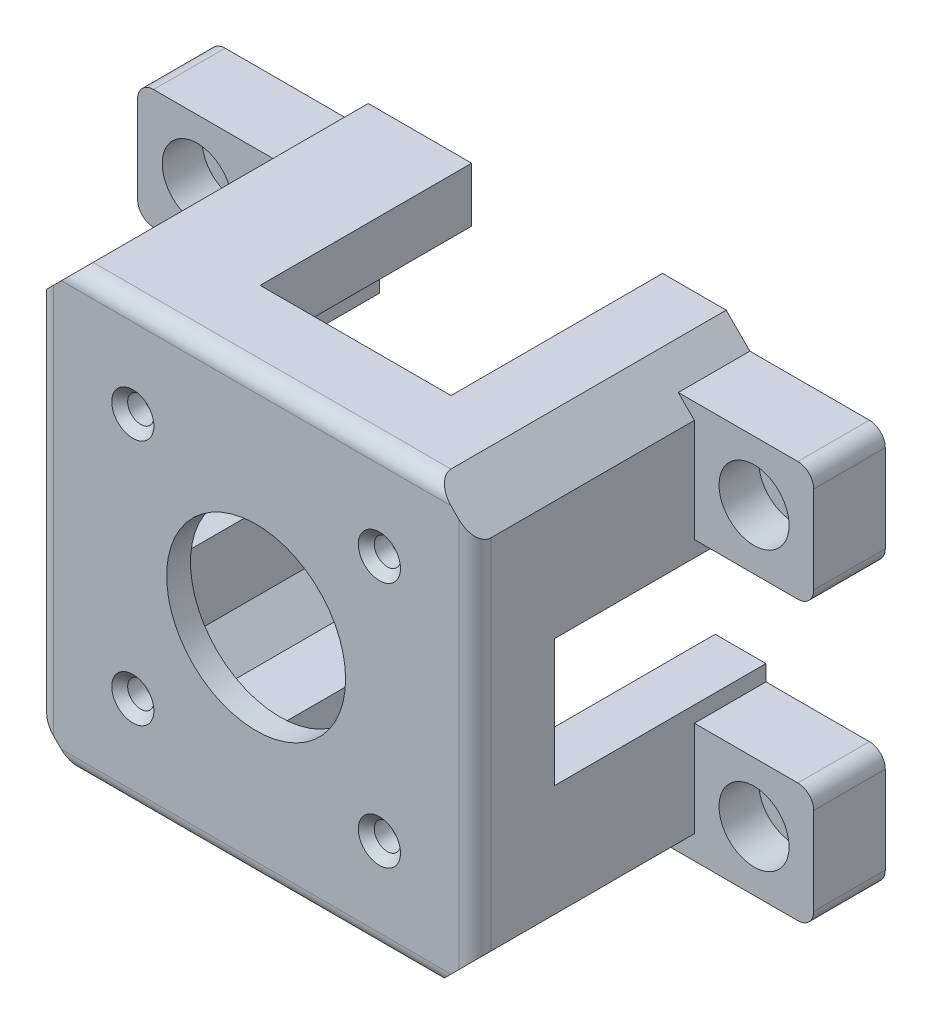
from build123d import *

# Parameters (mm, degrees)
SKETCH2_W           = 55
SKETCH2_H           = 55
BOSS_EXTRUDE1_DEPTH = 33.6
BOSS_EXTRUDE2_DEPTH = 3
SKETCH4_W           = 15
SKETCH4_H           = 15
SKETCH4_R           = 2.6
BOSS_EXTRUDE3_DEPTH = 9
CUT_EXTRUDE1_START  = -5
SKETCH6_R           = 4.4
SKETCH6_R_2         = 2.6
CUT_EXTRUDE1_DEPTH  = 5
CHAMFER1_SIZE       = 5
FILLET4_R           = 2
SKETCH7_W           = 24
SKETCH7_H           = 26.6
CUT_EXTRUDE2_DEPTH  = 67
SKETCH8_W           = 26.6
SKETCH8_H           = 16
CUT_EXTRUDE3_DEPTH  = 67
SKETCH10_R          = 1.65
CUT_EXTRUDE4_DEPTH  = 10
CHAMFER2_SIZE       = 1


with BuildPart() as part:
    # Sketch2 → Boss-Extrude1 (new body)
    with BuildSketch(Plane.XY):
        with Locations((0, 0.476186899)):
            Rectangle(SKETCH2_W, SKETCH2_H)
        Polygon((21.118377871, -17.280631787), (21.118377871, 17.280631787), (17.280631787, 21.118377871), (-17.280631787, 21.118377871), (-21.118377871, 17.280631787), (-21.118377871, -17.280631787), (-17.280631787, -21.118377871), (17.280631787, -21.118377871), align=None, mode=Mode.SUBTRACT)
    extrude(amount=BOSS_EXTRUDE1_DEPTH)

    # Sketch3 → Boss-Extrude2 (add)
    with BuildSketch(Plane.XY.offset(33.6)):
        with BuildLine():
            Line((-7.954951288, 8.431138187), (-18.961411379, 19.437598278))
            Line((-18.961411379, 19.437598278), (-21.118377871, 17.280631787))
            Line((-21.118377871, 17.280631787), (-21.118377871, -17.280631787))
            Line((-21.118377871, -17.280631787), (-19.437598278, -18.961411379))
            Line((-19.437598278, -18.961411379), (-7.954951288, -7.478764389))
            ThreePointArc((-7.954951288, -7.478764389), (-11.25, 0.476186899), (-7.954951288, 8.431138187))
        make_face()
        with BuildLine():
            Line((-7.954951288, -7.478764389), (-19.437598278, -18.961411379))
            Line((-19.437598278, -18.961411379), (-17.280631787, -21.118377871))
            Line((-17.280631787, -21.118377871), (17.280631787, -21.118377871))
            Line((17.280631787, -21.118377871), (19.437598278, -18.961411379))
            Line((19.437598278, -18.961411379), (7.954951288, -7.478764389))
            ThreePointArc((7.954951288, -7.478764389), (0, -10.773813101), (-7.954951288, -7.478764389))
        make_face()
        with BuildLine():
            Line((21.118377871, 17.280631787), (18.961411379, 19.437598278))
            Line((18.961411379, 19.437598278), (7.954951288, 8.431138187))
            ThreePointArc((7.954951288, 8.431138187), (10.393644741, 4.781375513), (11.25, 0.476186899))
            ThreePointArc((11.25, 0.476186899), (10.393644741, -3.829001715), (7.954951288, -7.478764389))
            Line((7.954951288, -7.478764389), (19.437598278, -18.961411379))
            Line((19.437598278, -18.961411379), (21.118377871, -17.280631787))
            Line((21.118377871, -17.280631787), (21.118377871, 17.280631787))
        make_face()
        with BuildLine():
            Line((-17.280631787, 21.118377871), (-18.961411379, 19.437598278))
            Line((-18.961411379, 19.437598278), (-7.954951288, 8.431138187))
            ThreePointArc((-7.954951288, 8.431138187), (0, 11.726186899), (7.954951288, 8.431138187))
            Line((7.954951288, 8.431138187), (18.961411379, 19.437598278))
            Line((18.961411379, 19.437598278), (17.280631787, 21.118377871))
            Line((17.280631787, 21.118377871), (-17.280631787, 21.118377871))
        make_face()
        Polygon((-18.961411379, 19.437598278), (-27.5, 27.976186899), (-27.5, -27.023813101), (-19.437598278, -18.961411379), (-21.118377871, -17.280631787), (-21.118377871, 17.280631787), align=None)
        Polygon((-19.437598278, -18.961411379), (-27.5, -27.023813101), (27.5, -27.023813101), (19.437598278, -18.961411379), (17.280631787, -21.118377871), (-17.280631787, -21.118377871), align=None)
        Polygon((27.5, -27.023813101), (27.5, 27.976186899), (18.961411379, 19.437598278), (21.118377871, 17.280631787), (21.118377871, -17.280631787), (19.437598278, -18.961411379), align=None)
        Polygon((27.5, 27.976186899), (-27.5, 27.976186899), (-18.961411379, 19.437598278), (-17.280631787, 21.118377871), (17.280631787, 21.118377871), (18.961411379, 19.437598278), align=None)
    extrude(amount=BOSS_EXTRUDE2_DEPTH)

    # Sketch4 → Boss-Extrude3 (add)
    # profile 1 of 4: a face of its own
    with BuildSketch(Plane(origin=(0, 0, 0), x_dir=(-1, 0, 0), z_dir=(0, 0, -1))):
        with Locations((-35, 17.5)):
            Rectangle(SKETCH4_W, SKETCH4_H)
        with Locations((-35, 17.5)):
            Circle(SKETCH4_R, mode=Mode.SUBTRACT)
    # profile 2 of 4: a face of its own
    with BuildSketch(Plane(origin=(0, 0, 0), x_dir=(-1, 0, 0), z_dir=(0, 0, -1))):
        with Locations((35, 17.5)):
            Rectangle(SKETCH4_W, SKETCH4_H)
        with Locations((35, 17.5)):
            Circle(SKETCH4_R, mode=Mode.SUBTRACT)
    # profile 3 of 4: a face of its own
    with BuildSketch(Plane(origin=(0, 0, 0), x_dir=(-1, 0, 0), z_dir=(0, 0, -1))):
        with Locations((-35, -17.5)):
            Rectangle(SKETCH4_W, SKETCH4_H)
        with Locations((-35, -17.5)):
            Circle(SKETCH4_R, mode=Mode.SUBTRACT)
    # profile 4 of 4: a face of its own
    with BuildSketch(Plane(origin=(0, 0, 0), x_dir=(-1, 0, 0), z_dir=(0, 0, -1))):
        with Locations((17.5, -34.523813101)):
            Rectangle(SKETCH4_W, SKETCH4_H)
        with Locations((17.5, -34.523813101)):
            Circle(SKETCH4_R, mode=Mode.SUBTRACT)
    extrude(amount=-BOSS_EXTRUDE3_DEPTH)

    # Sketch6 → Cut-Extrude1 (cut)
    # profile 1 of 4: a face of its own
    with BuildSketch(Plane.XY.offset(9).offset(CUT_EXTRUDE1_START)):
        with Locations((-17.5, -34.523813101)):
            Circle(SKETCH6_R)
    # profile 2 of 4: a face of its own
    with BuildSketch(Plane.XY.offset(9).offset(CUT_EXTRUDE1_START)):
        with Locations((-35, 17.5)):
            Circle(SKETCH6_R)
    # profile 3 of 4: a face of its own
    with BuildSketch(Plane.XY.offset(9).offset(CUT_EXTRUDE1_START)):
        with Locations((35, -17.5)):
            Circle(SKETCH6_R)
        with Locations(Location((35, -17.5, 0), (0, 0, 180))):
            Circle(SKETCH6_R_2, mode=Mode.SUBTRACT)
    # profile 4 of 4: a face of its own
    with BuildSketch(Plane.XY.offset(9).offset(CUT_EXTRUDE1_START)):
        with Locations((35, 17.5)):
            Circle(SKETCH6_R)
    extrude(amount=CUT_EXTRUDE1_DEPTH, mode=Mode.SUBTRACT)

    # Chamfer1
    chamfer1_edges = [part.edges().sort_by_distance(p)[0] for p in [
        (27.5, -27.023813101, 18.3),
        (-27.5, -27.023813101, 18.3),
        (27.5, 27.976186899, 18.3),
        (-27.5, 27.976186899, 18.3),
    ]]
    chamfer(chamfer1_edges, length=CHAMFER1_SIZE)

    # Fillet4
    fillet4_edges = [part.edges().sort_by_distance(p)[0] for p in [
        (0, 27.976186899, 36.6),
        (27.5, 0.476186899, 36.6),
        (0, -27.023813101, 36.6),
        (-27.5, 0.476186899, 36.6),
        (-25, -42.023813101, 4.5),
        (-10, -42.023813101, 4.5),
        (-42.5, 10, 4.5),
        (-42.5, 25, 4.5),
        (42.5, -25, 4.5),
        (42.5, -10, 4.5),
        (42.5, 10, 4.5),
        (42.5, 25, 4.5),
    ]]
    fillet(fillet4_edges, radius=FILLET4_R)

    # Sketch7 → Cut-Extrude2 (cut)
    with BuildSketch(Plane.XZ.offset(27.023813101)):
        with Locations((2.5, 13.3)):
            Rectangle(SKETCH7_W, SKETCH7_H)
    extrude(amount=-CUT_EXTRUDE2_DEPTH, mode=Mode.SUBTRACT)

    # Sketch8 → Cut-Extrude3 (cut)
    with BuildSketch(Plane.ZY.offset(27.5)):
        with Locations((13.3, 0)):
            Rectangle(SKETCH8_W, SKETCH8_H)
    extrude(amount=-CUT_EXTRUDE3_DEPTH, mode=Mode.SUBTRACT)


with BuildPart() as body_2:
    # Mirror2: mirrored copy
    add(part.part.mirror(Plane(origin=(-25, -42.023813101, 9), x_dir=(0, 0, 1), z_dir=(0, 1, 0))))


with BuildPart() as body_2_2:
    # Mirror3: mirrored copy
    add(body_2.part.mirror(Plane(origin=(-1.737426519, -112.023813101, 20.07988243), x_dir=(0, 0, 1), z_dir=(0, -1, 0))))

    # Sketch10 → Cut-Extrude4 (cut)
    with BuildSketch(Plane.XY.offset(36.6)):
        with Locations((-15.5, -124.023813101)):
            Circle(SKETCH10_R)
        with Locations((15.5, -124.023813101)):
            Circle(SKETCH10_R)
        with Locations((15.5, -155.023813101)):
            Circle(SKETCH10_R)
        with Locations((-15.5, -155.023813101)):
            Circle(SKETCH10_R)
    extrude(amount=-CUT_EXTRUDE4_DEPTH, mode=Mode.SUBTRACT)

    # Chamfer2
    chamfer2_edges = [body_2_2.edges().sort_by_distance(p)[0] for p in [
        (-17.15, -155.023813101, 36.6),
        (13.85, -155.023813101, 36.6),
        (13.85, -124.023813101, 36.6),
        (-17.15, -124.023813101, 36.6),
    ]]
    chamfer(chamfer2_edges, length=CHAMFER2_SIZE)


solid = body_2_2.part
